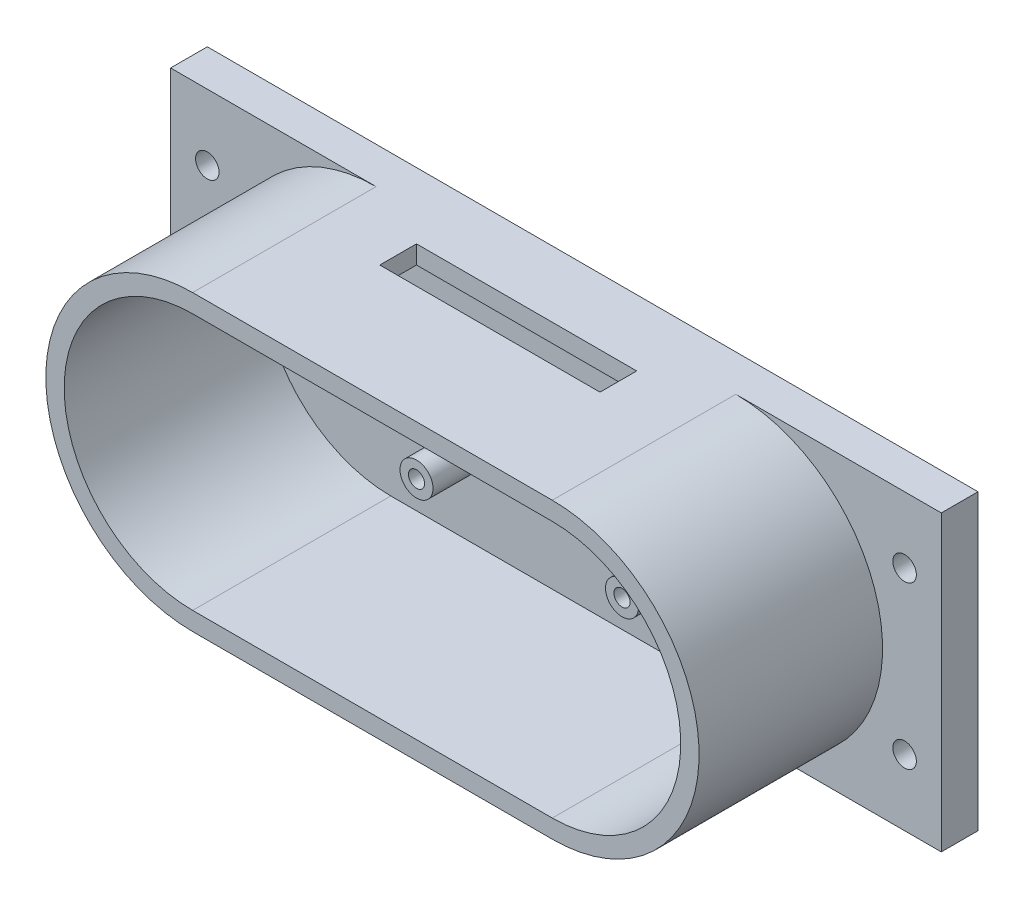
from build123d import *

# Parameters (mm, degrees)
EXTRUDE_1_DEPTH           = 30
SHELL_1_T                 = -2.5
SHELL_1_THICKNESS_2_DEPTH = 0.5
EXTRUDE_2_DEPTH           = 5
HOLE_WIZARD_M31_D         = 3.2
SKETCH_5_R                = 2.25
EXTRUDE_3_DEPTH           = 7
HOLE_WIZARD_M21_D         = 2.2
HOLE_WIZARD_M21_DEPTH     = 11.5
HOLE_WIZARD_M21_TIP       = 0.660946681
SKETCH_8_W                = 30
SKETCH_8_H                = 5
CUT_EXTRUDE_1_DEPTH       = 5


with BuildPart() as part:
    # Эскиз1 → Бобышка-Вытянуть1 (new body)
    with BuildSketch(Plane.XY):
        with BuildLine():
            Line((-24.5, 20), (24.5, 20))
            ThreePointArc((24.5, 20), (44.5, 0), (24.5, -20))
            Line((24.5, -20), (-24.5, -20))
            ThreePointArc((-24.5, -20), (-44.5, 0), (-24.5, 20))
        make_face()
    extrude(amount=EXTRUDE_1_DEPTH)

    # Оболочка1
    shell_1_openings = [part.faces().sort_by_distance(p)[0] for p in [
        (0, 0, 30),
    ]]
    offset(amount=SHELL_1_T, openings=shell_1_openings, kind=Kind.INTERSECTION)

    # Оболочка1 thickness 2 face (on inner face of the shell) → Оболочка1 thickness 2 (add)
    with BuildSketch(Plane(origin=(0, 0, 2.5), x_dir=(-1, 0, 0), z_dir=(0, 0, -1))):
        with BuildLine():
            Line((-24.5, 17.5), (24.5, 17.5))
            ThreePointArc((24.5, 17.5), (42, 0), (24.5, -17.5))
            Line((24.5, -17.5), (-24.5, -17.5))
            ThreePointArc((-24.5, -17.5), (-42, 0), (-24.5, 17.5))
        make_face()
    extrude(amount=-SHELL_1_THICKNESS_2_DEPTH)

    # Эскиз2 → Бобышка-Вытянуть2 (add)
    with BuildSketch(Plane.XY):
        with BuildLine():
            Line((-24.5, 20), (-52.5, 20))
            Line((-52.5, 20), (-52.5, -20))
            Line((-52.5, -20), (-24.5, -20))
            ThreePointArc((-24.5, -20), (-44.5, 0), (-24.5, 20))
        make_face()
        with BuildLine():
            Line((24.5, -20), (52.5, -20))
            Line((52.5, -20), (52.5, 20))
            Line((52.5, 20), (24.5, 20))
            ThreePointArc((24.5, 20), (44.5, 0), (24.5, -20))
        make_face()
    extrude(amount=EXTRUDE_2_DEPTH)

    # Отверстие с зазором M31 (through all)
    with Locations(Plane.XY.offset(30)):
        with Locations((-47.5, 11), (-47.5, -11), (47.5, -11), (47.5, 11)):
            Hole(HOLE_WIZARD_M31_D / 2)

    # Эскиз5 → Бобышка-Вытянуть3 (add)
    with BuildSketch(Plane.XY.offset(3)):
        with Locations(Location((-14, 6.75, 0), (0, 0, 180))):
            Circle(SKETCH_5_R)
        with Locations(Location((14, 6.75, 0), (0, 0, 180))):
            Circle(SKETCH_5_R)
        with Locations(Location((-14, -6.75, 0), (0, 0, 180))):
            Circle(SKETCH_5_R)
        with Locations(Location((14, -6.75, 0), (0, 0, 180))):
            Circle(SKETCH_5_R)
    extrude(amount=EXTRUDE_3_DEPTH)

    # Отверстие с зазором M21
    with Locations(Plane.XY.offset(10)):
        with Locations((-14, 6.75), (14, 6.75), (14, -6.75), (-14, -6.75)):
            Hole(HOLE_WIZARD_M21_D / 2, depth=HOLE_WIZARD_M21_DEPTH)
            with Locations((0, 0, -(HOLE_WIZARD_M21_DEPTH + HOLE_WIZARD_M21_TIP / 2))):  # 118° drill point
                Cone(0, HOLE_WIZARD_M21_D / 2, HOLE_WIZARD_M21_TIP, mode=Mode.SUBTRACT)

    # Эскиз8 → Вырез-Вытянуть1 (cut)
    with BuildSketch(Plane(origin=(0, 20, 0), x_dir=(1, 0, 0), z_dir=(0, 1, 0))):
        with Locations((0, -11.5)):
            Rectangle(SKETCH_8_W, SKETCH_8_H)
    extrude(amount=-CUT_EXTRUDE_1_DEPTH, mode=Mode.SUBTRACT)


solid = part.part
